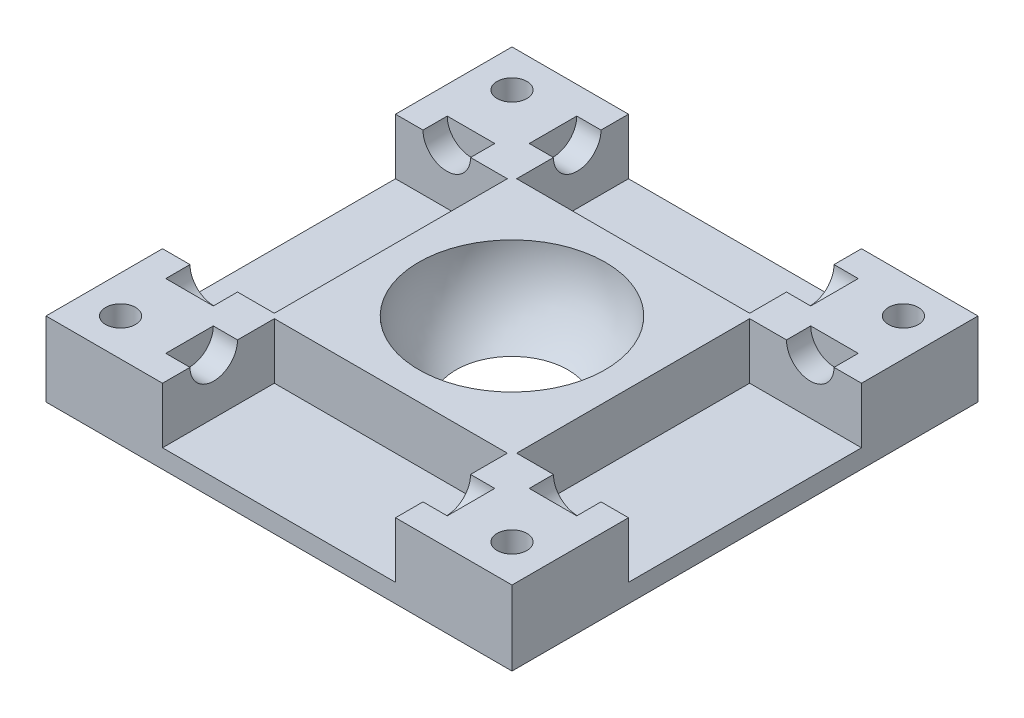
from build123d import *

# Parameters (mm, degrees)
SKETCH_1_W               = 50
SKETCH_1_H               = 50
EXTRUDE_1_DEPTH          = 16
SKETCH_3_R               = 1.6
CUT_EXTRUDE_1_DEPTH      = 39.807215824
SKETCH_6_W               = 25
SKETCH_6_H               = 12
CUT_EXTRUDE_3_DEPTH      = 12
SKETCH_7_R               = 2.55
CUT_EXTRUDE_4_DEPTH      = 15.1
PATTERN_CIRCULAR_2_COUNT = 4
SKETCH_8_W               = 50
SKETCH_8_H               = 50
CUT_EXTRUDE_5_DEPTH      = 8


with BuildPart() as part:
    # 草图1 → 凸台-拉伸1 (new body)
    with BuildSketch(Plane(origin=(0, 0, 0), x_dir=(1, 0, 0), z_dir=(0, 1, 0))):
        Rectangle(SKETCH_1_W, SKETCH_1_H)
    extrude(amount=EXTRUDE_1_DEPTH)

    # 草图2 → 切除-旋转1 (revolve, cut)
    with BuildSketch(Plane.XY):
        with BuildLine():
            Line((0, 18), (0, -2))
            ThreePointArc((0, -2), (10, 8), (0, 18))
        make_face()
    revolve(axis=Axis((0, 16, 0), (0, -1, 0)), mode=Mode.SUBTRACT)

    # 草图3 → 切除-拉伸1 (cut, through all)
    with BuildSketch(Plane(origin=(0, 16, 0), x_dir=(1, 0, 0), z_dir=(0, 1, 0))):
        with Locations(Location((-21, 21, 0), (0, 0, 270))):
            Circle(SKETCH_3_R)
        with Locations(Location((21, 21, 0), (0, 0, 270))):
            Circle(SKETCH_3_R)
        with Locations(Location((21, -21, 0), (0, 0, 270))):
            Circle(SKETCH_3_R)
        with Locations(Location((-21, -21, 0), (0, 0, 270))):
            Circle(SKETCH_3_R)
    extrude(amount=-CUT_EXTRUDE_1_DEPTH, mode=Mode.SUBTRACT)

    # 草图6 → 切除-拉伸3 (cut)
    with BuildSketch(Plane.XY.offset(25)):
        with Locations((0, 8)):
            Rectangle(SKETCH_6_W, SKETCH_6_H)
    cut_extrude_3 = extrude(amount=-CUT_EXTRUDE_3_DEPTH, mode=Mode.SUBTRACT)

    # 草图7 → 切除-拉伸4 (cut, symmetric)
    with BuildSketch(Plane(origin=(0, 0, 0), x_dir=(0, 0, -1), z_dir=(1, 0, 0))):
        with Locations(Location((-19.5, 8, 0), (0, 0, 180))):
            Circle(SKETCH_7_R)
    cut_extrude_4 = extrude(amount=CUT_EXTRUDE_4_DEPTH, both=True, mode=Mode.SUBTRACT)

    # 阵列(圆周)2: 切除-拉伸3, 切除-拉伸4 ×4 about axis
    pattern_circular_2_axis = Axis((0, 0, 0), (0, 1, 0))
    add([cut_extrude_3.rotate(pattern_circular_2_axis, i * 360 / PATTERN_CIRCULAR_2_COUNT) for i in range(1, PATTERN_CIRCULAR_2_COUNT)], mode=Mode.SUBTRACT)
    add([cut_extrude_4.rotate(pattern_circular_2_axis, i * 360 / PATTERN_CIRCULAR_2_COUNT) for i in range(1, PATTERN_CIRCULAR_2_COUNT)], mode=Mode.SUBTRACT)

    # 草图8 → 切除-拉伸5 (cut)
    with BuildSketch(Plane(origin=(0, 16, 0), x_dir=(1, 0, 0), z_dir=(0, 1, 0))):
        Rectangle(SKETCH_8_W, SKETCH_8_H)
    extrude(amount=-CUT_EXTRUDE_5_DEPTH, mode=Mode.SUBTRACT)


solid = part.part
